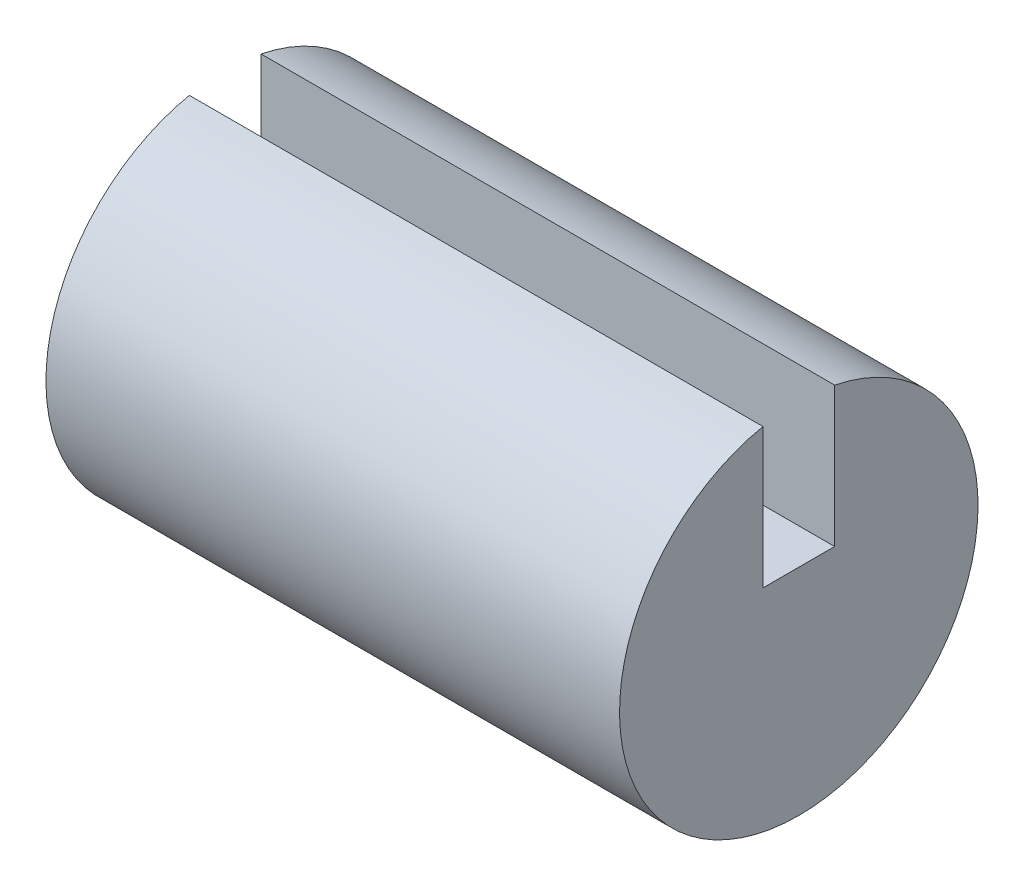
from build123d import *

# Parameters (mm, degrees)
SKETCH_1_R          = 2.5
EXTRUDE_1_DEPTH     = 8
SKETCH_2_R          = 0.5
CUT_EXTRUDE_2_DEPTH = 4
SKETCH_3_W          = 1
SKETCH_3_H          = 4
CUT_EXTRUDE_3_DEPTH = 8


with BuildPart() as part:
    # 草图1 → 凸台-拉伸1 (new body)
    with BuildSketch(Plane(origin=(0, 0, 0), x_dir=(0, 0, -1), z_dir=(1, 0, 0))):
        Circle(SKETCH_1_R)
    extrude(amount=EXTRUDE_1_DEPTH)

    # 草图2 → 切除-拉伸2 (cut, symmetric)
    with BuildSketch(Plane(origin=(0, 0, 0), x_dir=(1, 0, 0), z_dir=(0, 1, 0))):
        with Locations(Location((4, 0, 0), (0, 0, 270))):
            Circle(SKETCH_2_R)
    extrude(amount=CUT_EXTRUDE_2_DEPTH, both=True, mode=Mode.SUBTRACT)

    # 草图3 → 切除-拉伸3 (cut)
    with BuildSketch(Plane(origin=(8, 0, 0), x_dir=(0, 0, -1), z_dir=(1, 0, 0))):
        with Locations((0, 2.5)):
            Rectangle(SKETCH_3_W, SKETCH_3_H)
    extrude(amount=-CUT_EXTRUDE_3_DEPTH, mode=Mode.SUBTRACT)


solid = part.part
